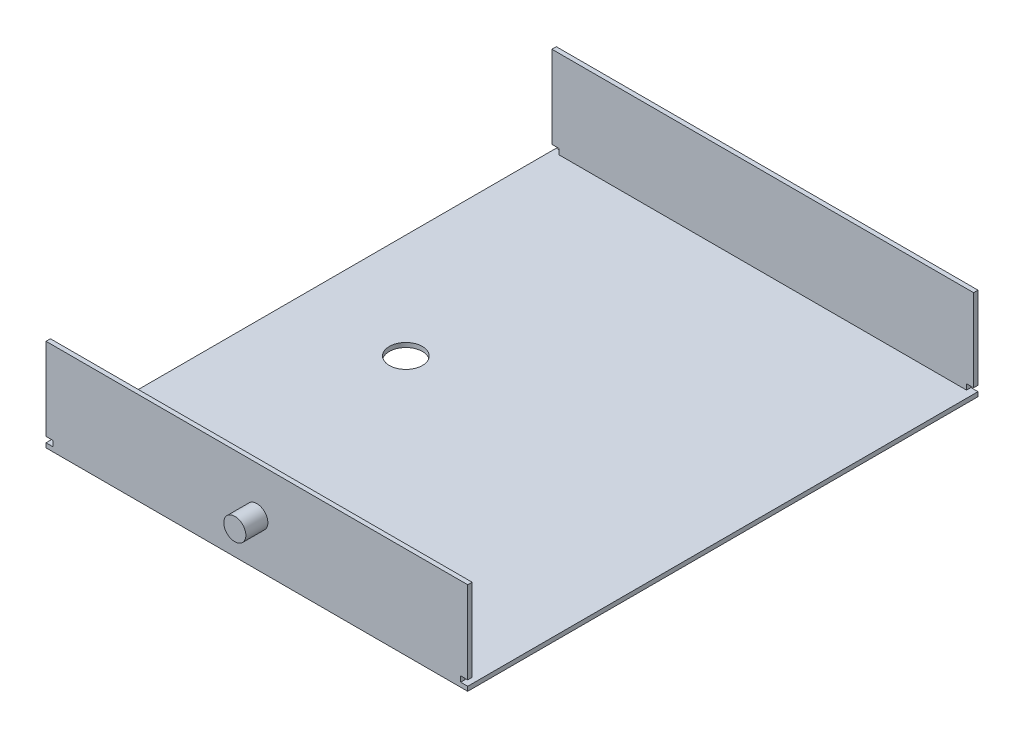
from build123d import *

# Parameters (mm, degrees)
SKETCH_2_W         = 191.4
SKETCH_2_H         = 231.6
EXTRUDE_1_DEPTH    = 2
SKETCH_3_W         = 185
SKETCH_3_H         = 2
EXTRUDE_2_DEPTH    = 2.5
SKETCH_4_W         = 191.4
SKETCH_4_H         = 2
EXTRUDE_3_DEPTH    = 37.4
SKETCH_7_R         = 5
EXTRUDE_5_DEPTH    = 10
SKETCH1_R          = 7.5
CUT_EXTRUDE1_DEPTH = 10


with BuildPart() as part:
    # 草图2 → 凸台-拉伸1 (new body)
    with BuildSketch(Plane(origin=(0, 0, 0), x_dir=(1, 0, 0), z_dir=(0, 1, 0))):
        Rectangle(SKETCH_2_W, SKETCH_2_H)
    extrude(amount=EXTRUDE_1_DEPTH)

    # 草图3 → 凸台-拉伸2 (add)
    with BuildSketch(Plane(origin=(0, 2, 0), x_dir=(1, 0, 0), z_dir=(0, 1, 0))):
        with Locations((0, 114.8)):
            Rectangle(SKETCH_3_W, SKETCH_3_H)
        with Locations((0, -114.8)):
            Rectangle(SKETCH_3_W, SKETCH_3_H)
    extrude(amount=EXTRUDE_2_DEPTH)

    # 草图4 → 凸台-拉伸3 (add)
    with BuildSketch(Plane(origin=(0, 4.5, 0), x_dir=(1, 0, 0), z_dir=(0, 1, 0))):
        with Locations((0, 114.8)):
            Rectangle(SKETCH_4_W, SKETCH_4_H)
        with Locations((0, -114.8)):
            Rectangle(SKETCH_4_W, SKETCH_4_H)
    extrude(amount=EXTRUDE_3_DEPTH)

    # 草图7 → 凸台-拉伸5 (add)
    with BuildSketch(Plane.XY.offset(115.8)):
        with Locations(Location((0, 20.95, 0), (0, 0, 180))):
            Circle(SKETCH_7_R)
    extrude(amount=EXTRUDE_5_DEPTH)

    # Sketch1 → Cut-Extrude1 (cut)
    with BuildSketch(Plane.XZ):
        with Locations(Location((-48.170733531, 0, 0), (0, 0, 270))):
            Circle(SKETCH1_R)
    extrude(amount=-CUT_EXTRUDE1_DEPTH, mode=Mode.SUBTRACT)


solid = part.part
